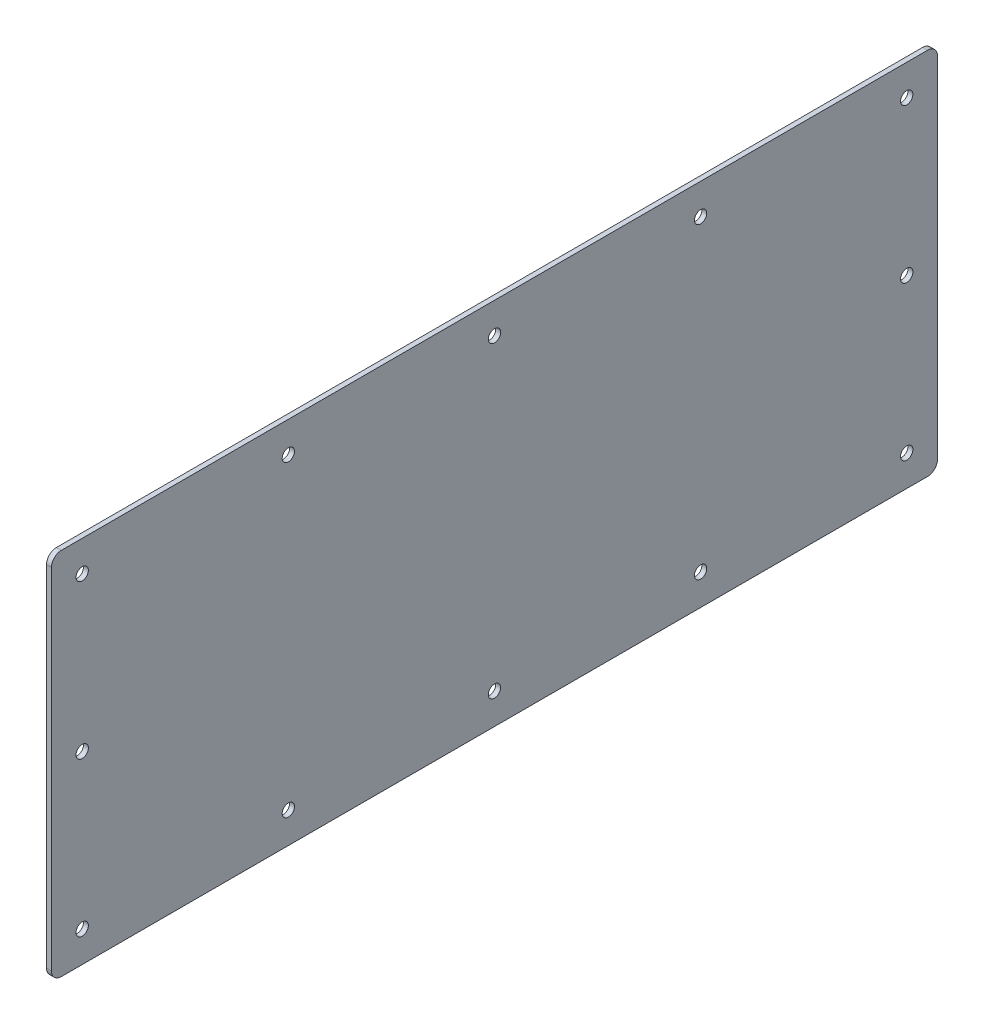
from build123d import *

# Parameters (mm, degrees)
SKETCH1_W               = 190.5
SKETCH1_H               = 457.2
BOSS_EXTRUDE1_DEPTH     = 2.54
FILLET1_R               = 5.08
CUT_EXTRUDE1_DEPTH      = 248.663025298
CUT_EXTRUDE1_DEPTH_BACK = 248.663025298
SKETCH2_R               = 3.175


with BuildPart() as part:
    # Sketch1 → Boss-Extrude1 (new body)
    with BuildSketch(Plane.YZ):
        Rectangle(SKETCH1_W, SKETCH1_H)
    extrude(amount=BOSS_EXTRUDE1_DEPTH)

    # Fillet1
    fillet1_edges = [part.edges().sort_by_distance(p)[0] for p in [
        (1.27, 95.25, -228.6),
        (1.27, -95.25, -228.6),
        (1.27, -95.25, 228.6),
        (1.27, 95.25, 228.6),
    ]]
    fillet(fillet1_edges, radius=FILLET1_R)

    # Sketch2 → Cut-Extrude1 (cut, two sides: drawn at the far end of the back side and taken through both)
    with BuildSketch(Plane.ZY.offset(-CUT_EXTRUDE1_DEPTH_BACK)):
        with Locations((-257.175, 0)):
            Circle(SKETCH2_R)
        with Locations((-106.3625, -79.375)):
            Circle(SKETCH2_R)
        with Locations((0, -79.375)):
            Circle(SKETCH2_R)
        with Locations((106.3625, -79.375)):
            Circle(SKETCH2_R)
        with Locations((212.725, -79.375)):
            Circle(SKETCH2_R)
        with Locations((212.725, 79.375)):
            Circle(SKETCH2_R)
        with Locations((212.725, 0)):
            Circle(SKETCH2_R)
        with Locations((-257.175, -79.375)):
            Circle(SKETCH2_R)
        with Locations((-363.5375, -79.375)):
            Circle(SKETCH2_R)
        with Locations((-257.175, 79.375)):
            Circle(SKETCH2_R)
        with Locations((-106.3625, 79.375)):
            Circle(SKETCH2_R)
        with Locations((-212.725, 79.375)):
            Circle(SKETCH2_R)
        with Locations((-212.725, 0)):
            Circle(SKETCH2_R)
        with Locations((-212.725, -79.375)):
            Circle(SKETCH2_R)
        with Locations((-576.2625, -79.375)):
            Circle(SKETCH2_R)
        with Locations((-469.9, -79.375)):
            Circle(SKETCH2_R)
        with Locations((106.3625, 79.375)):
            Circle(SKETCH2_R)
        with Locations((0, 79.375)):
            Circle(SKETCH2_R)
        with Locations((-682.625, 79.375)):
            Circle(SKETCH2_R)
        with Locations((-576.2625, 79.375)):
            Circle(SKETCH2_R)
        with Locations((-682.625, -79.375)):
            Circle(SKETCH2_R)
        with Locations((-469.9, 79.375)):
            Circle(SKETCH2_R)
        with Locations((-682.625, 0)):
            Circle(SKETCH2_R)
        with Locations((-363.5375, 79.375)):
            Circle(SKETCH2_R)
        with Locations((-831.85, -79.375)):
            Circle(SKETCH2_R)
        with Locations((-831.85, 79.375)):
            Circle(SKETCH2_R)
        with Locations((-727.075, 79.375)):
            Circle(SKETCH2_R)
        with Locations((-727.075, -79.375)):
            Circle(SKETCH2_R)
        with Locations((-936.625, 0)):
            Circle(SKETCH2_R)
        with Locations((-727.075, 0)):
            Circle(SKETCH2_R)
        with Locations((-936.625, 79.375)):
            Circle(SKETCH2_R)
        with Locations((-936.625, -79.375)):
            Circle(SKETCH2_R)
    extrude(amount=CUT_EXTRUDE1_DEPTH + CUT_EXTRUDE1_DEPTH_BACK, mode=Mode.SUBTRACT)


solid = part.part
